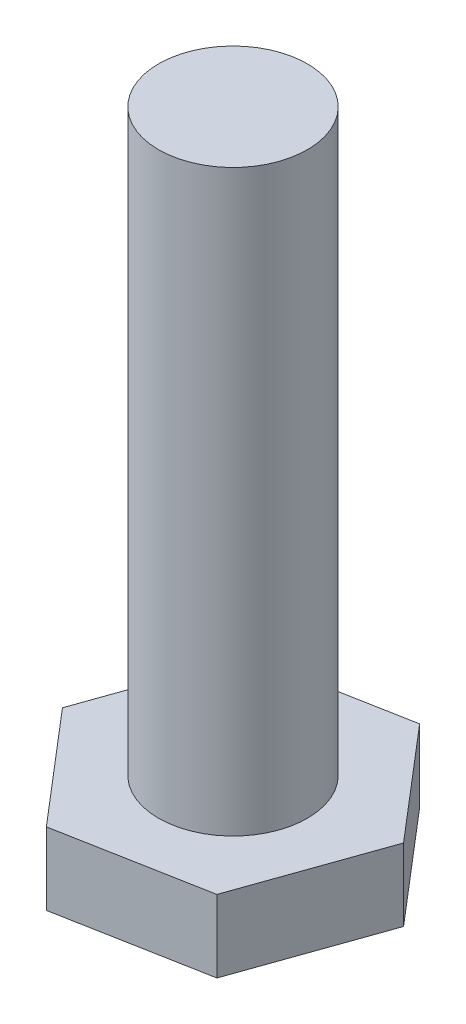
from build123d import *

# Parameters (mm, degrees)
BOSS_EXTRUDE1_DEPTH = 3.175
SKETCH2_R           = 3.2639
BOSS_EXTRUDE2_DEPTH = 25.4


with BuildPart() as part:
    # Sketch1 → Boss-Extrude1 (new body)
    with BuildSketch(Plane(origin=(0, 0, 0), x_dir=(1, 0, 0), z_dir=(0, 1, 0))):
        Polygon((2.1374183, 6.049297075), (-4.170135792, 4.875707083), (-6.307554091, -1.173589991), (-2.1374183, -6.049297075), (4.170135792, -4.875707083), (6.307554091, 1.173589991), align=None)
    extrude(amount=BOSS_EXTRUDE1_DEPTH)

    # Sketch2 → Boss-Extrude2 (add)
    with BuildSketch(Plane(origin=(0, 3.175, 0), x_dir=(1, 0, 0), z_dir=(0, 1, 0))):
        with Locations(Location((0, 0, 0), (0, 0, 270))):
            Circle(SKETCH2_R)
    extrude(amount=BOSS_EXTRUDE2_DEPTH)


solid = part.part
